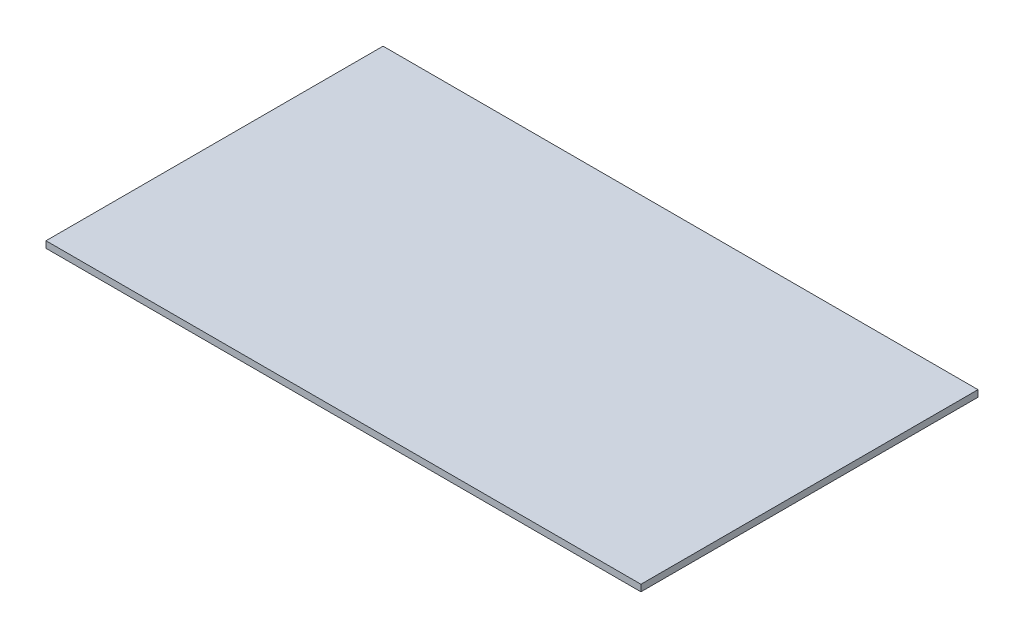
from build123d import *

# Parameters (mm, degrees)
SKETCH1_W           = 286.36214
SKETCH1_H           = 3.175
BOSS_EXTRUDE1_DEPTH = 162.23234


with BuildPart() as part:
    # Sketch1 → Boss-Extrude1 (new body)
    with BuildSketch(Plane.XY):
        Rectangle(SKETCH1_W, SKETCH1_H)
    extrude(amount=BOSS_EXTRUDE1_DEPTH)


solid = part.part
